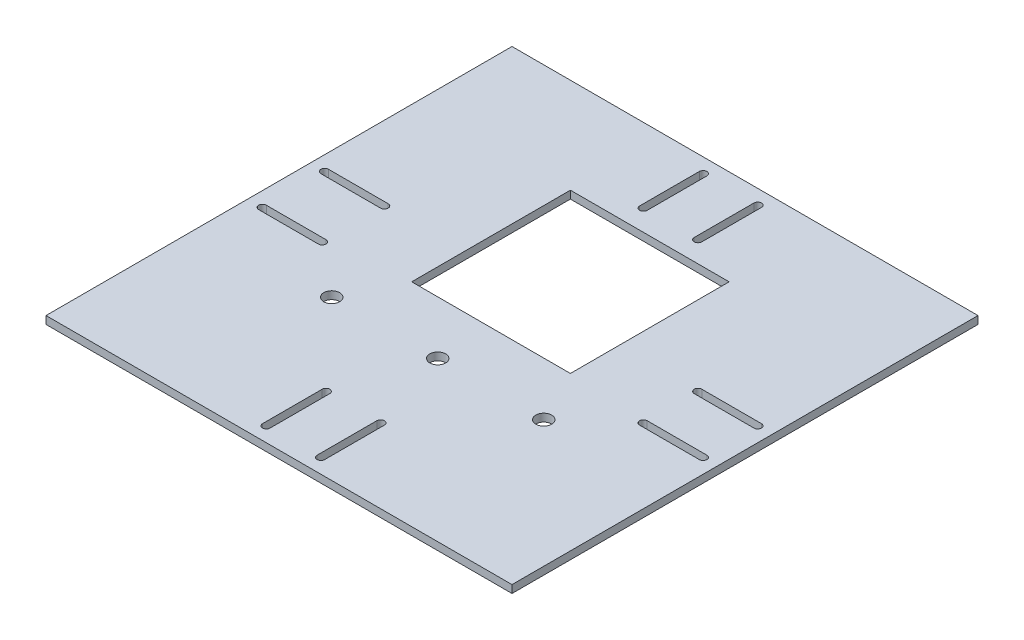
from build123d import *

# Parameters (mm, degrees)
SKETCH3_W           = 186.436
SKETCH3_H           = 186.436
BOSS_EXTRUDE1_DEPTH = 3.0988
CUT_EXTRUDE1_DEPTH  = 264.678529186
CUT_EXTRUDE2_REACH  = 265.679
SKETCH5_R           = 3.175
SKETCH5_W           = 63.5
SKETCH5_H           = 63.5


with BuildPart() as part:
    # Sketch3 → Boss-Extrude1 (new body)
    with BuildSketch(Plane(origin=(0, 0, 0), x_dir=(1, 0, 0), z_dir=(0, 1, 0))):
        with Locations((93.218, 93.218)):
            Rectangle(SKETCH3_W, SKETCH3_H)
    extrude(amount=BOSS_EXTRUDE1_DEPTH)

    # Sketch4 → Cut-Extrude1 (cut, through all)
    with BuildSketch(Plane(origin=(0, 3.0988, 0), x_dir=(1, 0, 0), z_dir=(0, 1, 0))):
        with BuildLine():
            Line((5.842, 82.296), (29.718, 82.296))
            ThreePointArc((29.718, 82.296), (31.242, 80.772), (29.718, 79.248))
            Line((29.718, 79.248), (5.842, 79.248))
            ThreePointArc((5.842, 79.248), (4.318, 80.772), (5.842, 82.296))
        make_face()
        with BuildLine():
            Line((5.842, 104.14), (29.718, 104.14))
            ThreePointArc((29.718, 104.14), (31.242, 105.664), (29.718, 107.188))
            Line((29.718, 107.188), (5.842, 107.188))
            ThreePointArc((5.842, 107.188), (4.318, 105.664), (5.842, 104.14))
        make_face()
        with BuildLine():
            Line((80.772, 29.718), (80.772, 5.842))
            ThreePointArc((80.772, 5.842), (82.296, 4.318), (83.82, 5.842))
            Line((83.82, 5.842), (83.82, 29.718))
            ThreePointArc((83.82, 29.718), (82.296, 31.242), (80.772, 29.718))
        make_face()
        with BuildLine():
            Line((105.664, 5.842), (105.664, 29.718))
            ThreePointArc((105.664, 29.718), (104.14, 31.242), (102.616, 29.718))
            Line((102.616, 29.718), (102.616, 5.842))
            ThreePointArc((102.616, 5.842), (104.14, 4.318), (105.664, 5.842))
        make_face()
        with BuildLine():
            Line((156.718, 83.82), (180.594, 83.82))
            ThreePointArc((180.594, 83.82), (182.118, 82.296), (180.594, 80.772))
            Line((180.594, 80.772), (156.718, 80.772))
            ThreePointArc((156.718, 80.772), (155.194, 82.296), (156.718, 83.82))
        make_face()
        with BuildLine():
            Line((156.718, 102.616), (180.594, 102.616))
            ThreePointArc((180.594, 102.616), (182.118, 104.14), (180.594, 105.664))
            Line((180.594, 105.664), (156.718, 105.664))
            ThreePointArc((156.718, 105.664), (155.194, 104.14), (156.718, 102.616))
        make_face()
        with BuildLine():
            Line((80.772, 180.594), (80.772, 156.718))
            ThreePointArc((80.772, 156.718), (82.296, 155.194), (83.82, 156.718))
            Line((83.82, 156.718), (83.82, 180.594))
            ThreePointArc((83.82, 180.594), (82.296, 182.118), (80.772, 180.594))
        make_face()
        with BuildLine():
            Line((105.664, 156.718), (105.664, 180.594))
            ThreePointArc((105.664, 180.594), (104.14, 182.118), (102.616, 180.594))
            Line((102.616, 180.594), (102.616, 156.718))
            ThreePointArc((102.616, 156.718), (104.14, 155.194), (105.664, 156.718))
        make_face()
    extrude(amount=-CUT_EXTRUDE1_DEPTH, mode=Mode.SUBTRACT)

    # Sketch5 → Cut-Extrude2 (cut, up to next)
    with BuildSketch(Plane(origin=(0, 3.0988, 0), x_dir=(1, 0, 0), z_dir=(0, 1, 0)), mode=Mode.PRIVATE) as cut_extrude2_sk1:
        with Locations(Location((50.8, 63.5, 0), (0, 0, 270))):
            Circle(SKETCH5_R)
    cut_extrude2_tool1 = extrude(cut_extrude2_sk1.sketch, amount=-CUT_EXTRUDE2_REACH, mode=Mode.PRIVATE) & part.part
    # Sketch5 → Cut-Extrude2 (cut, up to next)
    with BuildSketch(Plane(origin=(0, 3.0988, 0), x_dir=(1, 0, 0), z_dir=(0, 1, 0)), mode=Mode.PRIVATE) as cut_extrude2_sk2:
        with Locations(Location((93.218, 63.5, 0), (0, 0, 270))):
            Circle(SKETCH5_R)
    cut_extrude2_tool2 = extrude(cut_extrude2_sk2.sketch, amount=-CUT_EXTRUDE2_REACH, mode=Mode.PRIVATE) & part.part
    # Sketch5 → Cut-Extrude2 (cut, up to next)
    with BuildSketch(Plane(origin=(0, 3.0988, 0), x_dir=(1, 0, 0), z_dir=(0, 1, 0)), mode=Mode.PRIVATE) as cut_extrude2_sk3:
        with Locations(Location((135.636, 63.5, 0), (0, 0, 270))):
            Circle(SKETCH5_R)
    cut_extrude2_tool3 = extrude(cut_extrude2_sk3.sketch, amount=-CUT_EXTRUDE2_REACH, mode=Mode.PRIVATE) & part.part
    # Sketch5 → Cut-Extrude2 (cut, up to next)
    with BuildSketch(Plane(origin=(0, 3.0988, 0), x_dir=(1, 0, 0), z_dir=(0, 1, 0)), mode=Mode.PRIVATE) as cut_extrude2_sk4:
        with Locations((93.218, 116.586)):
            Rectangle(SKETCH5_W, SKETCH5_H)
    cut_extrude2_tool4 = extrude(cut_extrude2_sk4.sketch, amount=-CUT_EXTRUDE2_REACH, mode=Mode.PRIVATE) & part.part
    add(cut_extrude2_tool1.solids().sort_by_distance((50.8, 3.0988, -63.5))[0], mode=Mode.SUBTRACT)
    add(cut_extrude2_tool2.solids().sort_by_distance((93.218, 3.0988, -63.5))[0], mode=Mode.SUBTRACT)
    add(cut_extrude2_tool3.solids().sort_by_distance((135.636, 3.0988, -63.5))[0], mode=Mode.SUBTRACT)
    add(cut_extrude2_tool4.solids().sort_by_distance((93.218, 3.0988, -116.586))[0], mode=Mode.SUBTRACT)


solid = part.part
